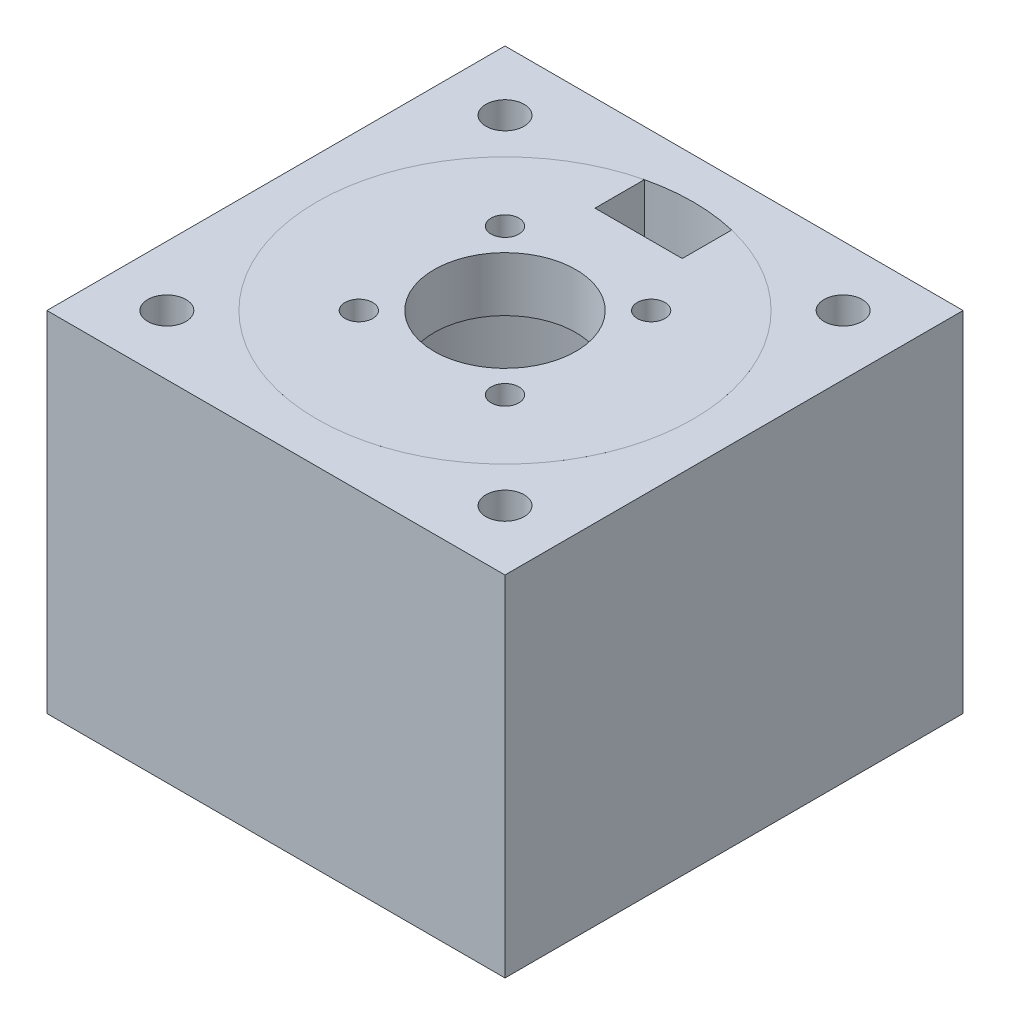
from build123d import *

# Parameters (mm, degrees)
SKETCH_1_R      = 1.275
SKETCH_1_R_2    = 6.5
EXTRUDE_1_DEPTH = 5
SKETCH_2_W      = 42
SKETCH_2_H      = 42
SKETCH_2_R      = 1.75
SKETCH_2_R_2    = 17.5
EXTRUDE_2_DEPTH = 27
SKETCH_3_W      = 42
SKETCH_3_H      = 42
SKETCH_3_R      = 1.75
SKETCH_3_R_2    = 17.5
SKETCH_3_R_3    = 17.25
EXTRUDE_3_DEPTH = 5


with BuildPart() as part:
    # 草图1 → 凸台-拉伸1 (new body)
    with BuildSketch(Plane(origin=(0, 0, 0), x_dir=(1, 0, 0), z_dir=(0, 1, 0))):
        with BuildLine():
            Line((-4, 12.25), (-4, 16.779824195))
            ThreePointArc((-4, 16.779824195), (-10.690240877, -13.538140567), (17.25, 0))
            ThreePointArc((17.25, 0), (13.538140567, 10.690240877), (4, 16.779824195))
            Line((4, 16.779824195), (4, 12.25))
            Line((4, 12.25), (-4, 12.25))
        make_face()
        with Locations(Location((-6.7, -6.7, 0), (0, 0, 270))):
            Circle(SKETCH_1_R, mode=Mode.SUBTRACT)
        with Locations(Location((6.7, -6.7, 0), (0, 0, 270))):
            Circle(SKETCH_1_R, mode=Mode.SUBTRACT)
        with Locations(Location((0, 0, 0), (0, 0, 270))):
            Circle(SKETCH_1_R_2, mode=Mode.SUBTRACT)
        with Locations(Location((-6.7, 6.7, 0), (0, 0, 270))):
            Circle(SKETCH_1_R, mode=Mode.SUBTRACT)
        with Locations(Location((6.7, 6.7, 0), (0, 0, 270))):
            Circle(SKETCH_1_R, mode=Mode.SUBTRACT)
    extrude(amount=EXTRUDE_1_DEPTH)


with BuildPart() as body_2:
    # 草图2 → 凸台-拉伸2 (new body)
    with BuildSketch(Plane.XZ):
        Rectangle(SKETCH_2_W, SKETCH_2_H)
        with Locations(Location((-15.5, -15.5, 0), (0, 0, 270))):
            Circle(SKETCH_2_R, mode=Mode.SUBTRACT)
        with Locations(Location((15.5, -15.5, 0), (0, 0, 270))):
            Circle(SKETCH_2_R, mode=Mode.SUBTRACT)
        with Locations(Location((-15.5, 15.5, 0), (0, 0, 270))):
            Circle(SKETCH_2_R, mode=Mode.SUBTRACT)
        with Locations(Location((0, 0, 0), (0, 0, 270))):
            Circle(SKETCH_2_R_2, mode=Mode.SUBTRACT)
        with Locations(Location((15.5, 15.5, 0), (0, 0, 270))):
            Circle(SKETCH_2_R, mode=Mode.SUBTRACT)
    extrude(amount=EXTRUDE_2_DEPTH)

    # 草图3 → 凸台-拉伸3 (add)
    # profile 1 of 2: a face of its own
    with BuildSketch(Plane(origin=(0, 0, 0), x_dir=(1, 0, 0), z_dir=(0, 1, 0))):
        Rectangle(SKETCH_3_W, SKETCH_3_H)
        with Locations(Location((15.5, -15.5, 0), (0, 0, 270))):
            Circle(SKETCH_3_R, mode=Mode.SUBTRACT)
        with Locations(Location((-15.5, 15.5, 0), (0, 0, 270))):
            Circle(SKETCH_3_R, mode=Mode.SUBTRACT)
        with Locations(Location((15.5, 15.5, 0), (0, 0, 270))):
            Circle(SKETCH_3_R, mode=Mode.SUBTRACT)
        with Locations(Location((-15.5, -15.5, 0), (0, 0, 270))):
            Circle(SKETCH_3_R, mode=Mode.SUBTRACT)
        with Locations(Location((0, 0, 0), (0, 0, 90))):
            Circle(SKETCH_3_R_2, mode=Mode.SUBTRACT)
    # profile 2 of 2: a face of its own
    with BuildSketch(Plane(origin=(0, 0, 0), x_dir=(1, 0, 0), z_dir=(0, 1, 0))):
        with Locations(Location((0, 0, 0), (0, 0, 90))):
            Circle(SKETCH_3_R_2)
        with Locations(Location((0, 0, 0), (0, 0, 270))):
            Circle(SKETCH_3_R_3, mode=Mode.SUBTRACT)
    extrude(amount=EXTRUDE_3_DEPTH)


solid = Compound([part.part, body_2.part])
